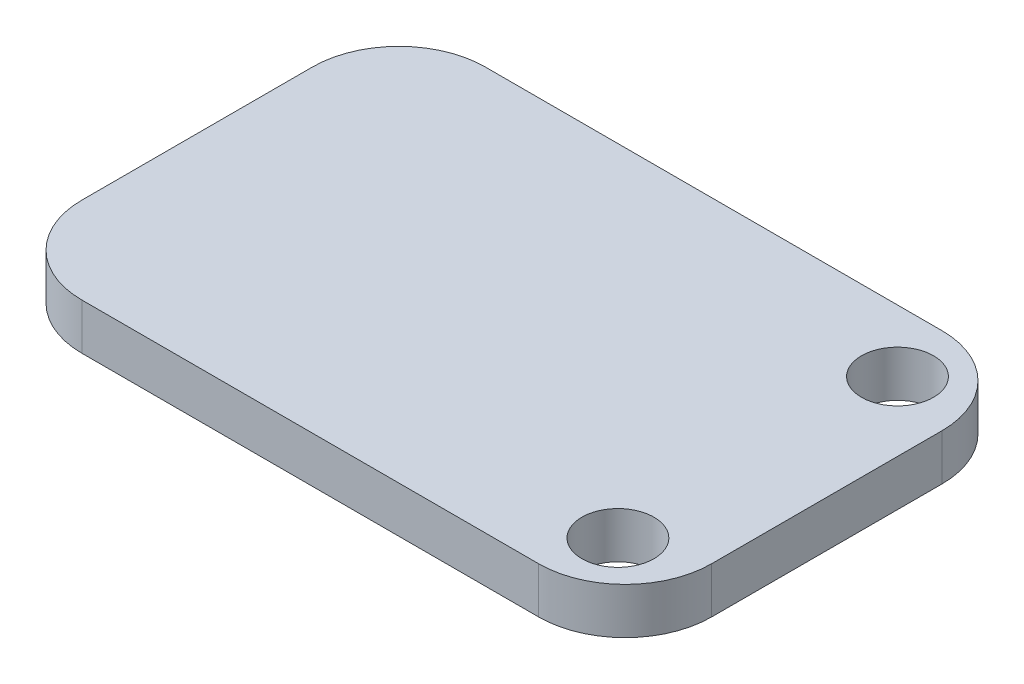
from build123d import *

# Parameters (mm, degrees)
SKETCH1_R           = 1.25
BOSS_EXTRUDE1_DEPTH = 1.6


with BuildPart() as part:
    # Sketch1 → Boss-Extrude1 (new body)
    with BuildSketch(Plane(origin=(0, 0, 0), x_dir=(1, 0, 0), z_dir=(0, 1, 0))):
        with BuildLine():
            Line((-11.1, 7), (4.75, 7))
            ThreePointArc((4.75, 7), (6.871320344, 6.121320344), (7.75, 4))
            Line((7.75, 4), (7.75, -4))
            ThreePointArc((7.75, -4), (6.871320344, -6.121320344), (4.75, -7))
            Line((4.75, -7), (-11.1, -7))
            ThreePointArc((-11.1, -7), (-13.221320344, -6.121320344), (-14.1, -4))
            Line((-14.1, -4), (-14.1, 4))
            ThreePointArc((-14.1, 4), (-13.221320344, 6.121320344), (-11.1, 7))
        make_face()
        with Locations(Location((5.35, 4.85, 0), (0, 0, 270))):
            Circle(SKETCH1_R, mode=Mode.SUBTRACT)
        with Locations(Location((5.35, -4.85, 0), (0, 0, 270))):
            Circle(SKETCH1_R, mode=Mode.SUBTRACT)
    extrude(amount=-BOSS_EXTRUDE1_DEPTH)


solid = part.part
